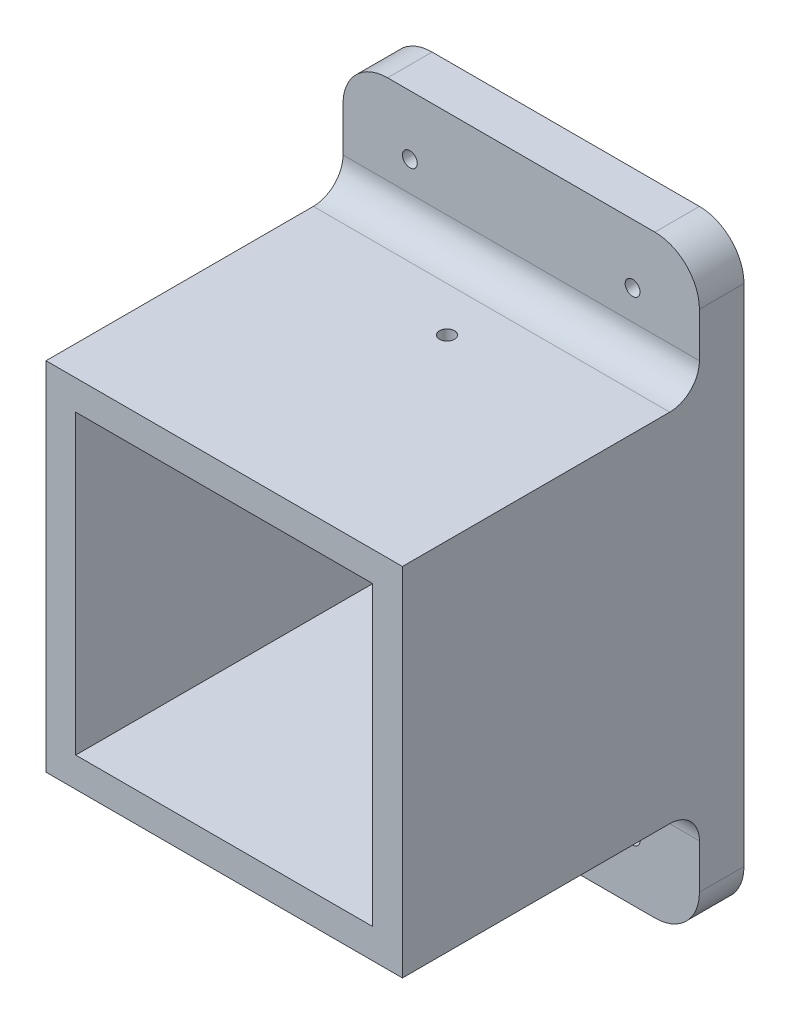
from build123d import *

# Parameters (mm, degrees)
SKETCH1_W                       = 120
SKETCH1_H                       = 120
SKETCH1_W_2                     = 100
SKETCH1_H_2                     = 100
BOSS_EXTRUDE1_DEPTH             = 100
SKETCH2_W                       = 120
SKETCH2_H                       = 40
SKETCH2_H_2                     = 120
SKETCH2_W_2                     = 100
SKETCH2_H_3                     = 100
BOSS_EXTRUDE2_DEPTH             = 15
F_5_0MM_DOWEL_HOLE2_D           = 5
F_5_0MM_DOWEL_HOLE2_CSINK_D     = 5.05
F_5_0MM_DOWEL_HOLE2_CSINK_ANGLE = 90
F_5_0MM_DOWEL_HOLE1_D           = 5
F_5_0MM_DOWEL_HOLE1_CSINK_D     = 5.05
F_5_0MM_DOWEL_HOLE1_CSINK_ANGLE = 90
FILLET1_R                       = 15
FILLET2_R                       = 10


with BuildPart() as part:
    # Sketch1 → Boss-Extrude1 (new body)
    with BuildSketch(Plane(origin=(0, 0, 0), x_dir=(0, 1, 0), z_dir=(0, 0, 1))):
        Rectangle(SKETCH1_W, SKETCH1_H)
        Rectangle(SKETCH1_W_2, SKETCH1_H_2, mode=Mode.SUBTRACT)
    extrude(amount=BOSS_EXTRUDE1_DEPTH)

    # Sketch2 → Boss-Extrude2 (add)
    # profile 1 of 4: a face of its own
    with BuildSketch(Plane(origin=(0, 0, 0), x_dir=(1, 0, 0), z_dir=(0, 0, -1))):
        with Locations((0, 80)):
            Rectangle(SKETCH2_W, SKETCH2_H)
    # profile 2 of 4: a face of its own
    with BuildSketch(Plane(origin=(0, 0, 0), x_dir=(1, 0, 0), z_dir=(0, 0, -1))):
        with Locations((0, -80)):
            Rectangle(SKETCH2_W, SKETCH2_H)
    # profile 3 of 4: a face of its own
    with BuildSketch(Plane(origin=(0, 0, 0), x_dir=(1, 0, 0), z_dir=(0, 0, -1))):
        Rectangle(SKETCH2_W, SKETCH2_H_2)
        Rectangle(SKETCH2_W_2, SKETCH2_H_3, mode=Mode.SUBTRACT)
    # profile 4 of 4: a face of its own
    with BuildSketch(Plane(origin=(0, 0, 0), x_dir=(1, 0, 0), z_dir=(0, 0, -1))):
        Rectangle(SKETCH2_W_2, SKETCH2_H_3)
    extrude(amount=BOSS_EXTRUDE2_DEPTH)

    # Ø5.0mm Dowel Hole2 (through all)
    with Locations(Plane(origin=(0, 0, -15), x_dir=(1, 0, 0), z_dir=(0, 0, -1))):
        with Locations((37.5, -80), (-37.5, 80), (37.5, 80), (-37.5, -80)):
            CounterSinkHole(F_5_0MM_DOWEL_HOLE2_D / 2, F_5_0MM_DOWEL_HOLE2_CSINK_D / 2, counter_sink_angle=F_5_0MM_DOWEL_HOLE2_CSINK_ANGLE)

    # Ø5.0mm Dowel Hole1 (through all)
    with Locations(Plane(origin=(0, 60, 0), x_dir=(-1, 0, 0), z_dir=(0, 1, 0))):
        with Locations((0, 25)):
            CounterSinkHole(F_5_0MM_DOWEL_HOLE1_D / 2, F_5_0MM_DOWEL_HOLE1_CSINK_D / 2, counter_sink_angle=F_5_0MM_DOWEL_HOLE1_CSINK_ANGLE)

    # Fillet1
    fillet1_edges = [part.edges().sort_by_distance(p)[0] for p in [
        (60, -100, -7.5),
        (-60, -100, -7.5),
        (-60, 100, -7.5),
        (60, 100, -7.5),
    ]]
    fillet(fillet1_edges, radius=FILLET1_R)

    # Fillet2
    fillet2_edges = [part.edges().sort_by_distance(p)[0] for p in [
        (0, 60, 0),
        (0, -60, 0),
    ]]
    fillet(fillet2_edges, radius=FILLET2_R)


solid = part.part
